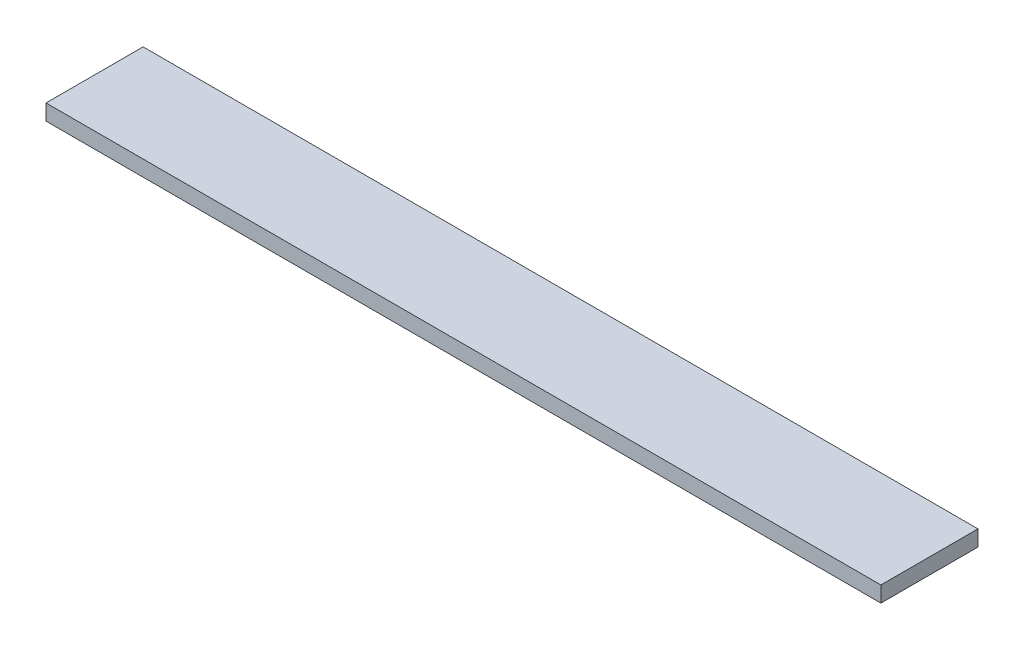
from build123d import *

# Parameters (mm, degrees)
SKETCH2_W           = 2019.3
SKETCH2_H           = 234.95
BOSS_EXTRUDE1_DEPTH = 38.1


with BuildPart() as part:
    # Sketch2 → Boss-Extrude1 (new body)
    with BuildSketch(Plane(origin=(0, 0, 0), x_dir=(1, 0, 0), z_dir=(0, 1, 0))):
        with Locations((-10506.6703125, 5056.98125)):
            Rectangle(SKETCH2_W, SKETCH2_H)
    extrude(amount=BOSS_EXTRUDE1_DEPTH)


solid = part.part
